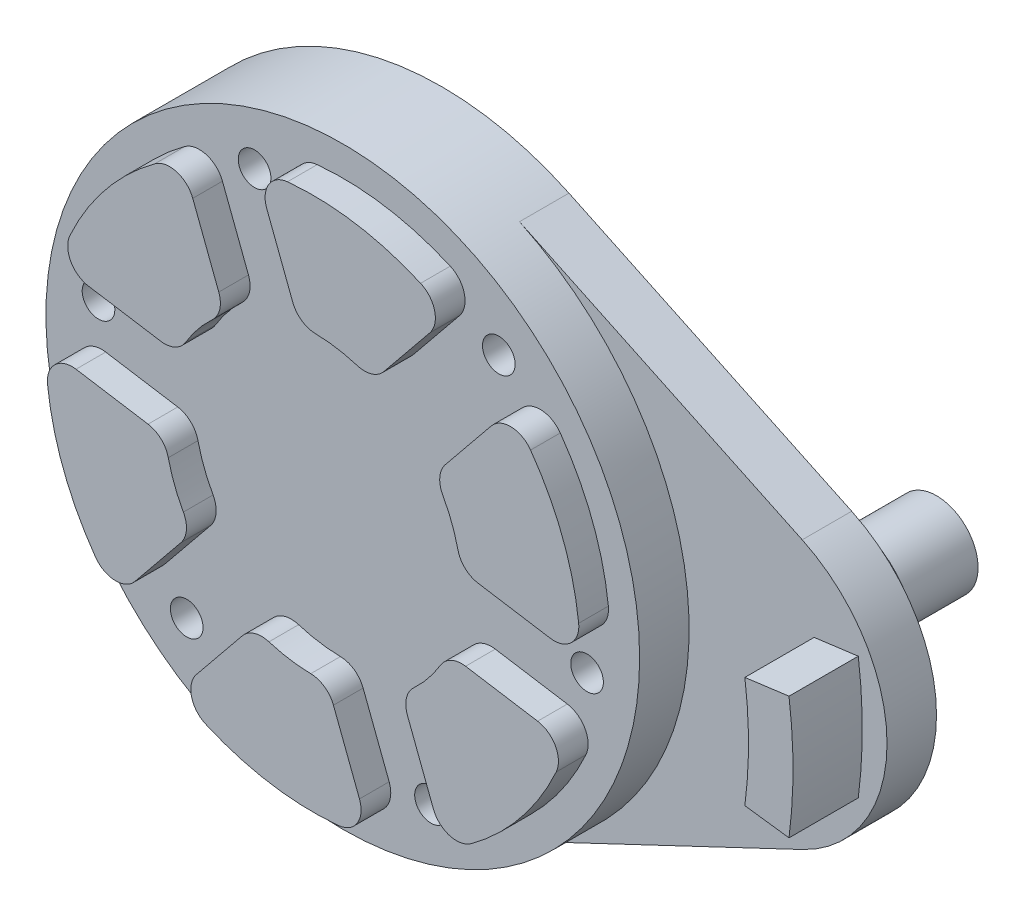
from build123d import *

# Parameters (mm, degrees)
EXTRUDE_1_DEPTH     = 10
EXTRUDE_2_DEPTH     = 3
CUT_EXTRUDE_1_DEPTH = 60.160797831
CUT_EXTRUDE_START   = -5
CUT_EXTRUDE_2_DEPTH = 5
SKETCH_6_R          = 4.2
EXTRUDE_3_DEPTH     = 15
SKETCH_7_R          = 8
EXTRUDE_4_DEPTH     = 5
EXTRUDE_6_DEPTH     = 7


with BuildPart() as part:
    # 草图1 → 凸台-拉伸1 (new body)
    with BuildSketch(Plane.XY):
        with BuildLine():
            Line((12.857142857, 27.105237087), (41.428571429, 13.552618544))
            ThreePointArc((41.428571429, 13.552618544), (50, 0), (41.428571429, -13.552618544))
            Line((41.428571429, -13.552618544), (12.857142857, -27.105237087))
            ThreePointArc((12.857142857, -27.105237087), (-30, 0), (12.857142857, 27.105237087))
        make_face()
    extrude(amount=EXTRUDE_1_DEPTH)

    # 草图2 → 凸台-拉伸2 (add)
    with BuildSketch(Plane.XY.offset(10)):
        with BuildLine():
            Line((23.957377721, 0.209887463), (16.67642367, 1.377277592))
            ThreePointArc((16.67642367, 1.377277592), (15.360611936, 2.023540765), (14.633319135, 3.296357245))
            ThreePointArc((14.633319135, 3.296357245), (14.013905466, 5.34887405), (13.10820337, 7.292119336))
            ThreePointArc((13.10820337, 7.292119336), (12.830802367, 8.073818452), (12.824431404, 8.903254546))
            ThreePointArc((12.824431404, 8.903254546), (13.010978482, 9.528656304), (13.353035008, 10.084466078))
            Line((13.353035008, 10.084466078), (18.004501541, 15.806262185))
            ThreePointArc((18.004501541, 15.806262185), (20.022964964, 16.728032941), (21.979510308, 15.681234856))
            ThreePointArc((21.979510308, 15.681234856), (25.225029838, 9.62797329), (26.838176005, 2.95166203))
            ThreePointArc((26.838176005, 2.95166203), (26.85239584, 2.616563886), (26.821632235, 2.282578003))
            ThreePointArc((26.821632235, 2.282578003), (25.818773244, 0.6530262), (23.957377721, 0.209887463))
        make_face()
        with BuildLine():
            Line((15.409921311, -6.521834496), (22.690875361, -7.689224625))
            ThreePointArc((22.690875361, -7.689224625), (24.498383964, -8.976379847), (24.570102902, -11.194196862))
            ThreePointArc((24.570102902, -11.194196862), (20.950584375, -17.031530006), (15.975302304, -21.766711196))
            ThreePointArc((15.975302304, -21.766711196), (15.692208716, -21.946575006), (15.387586654, -22.086925885))
            ThreePointArc((15.387586654, -22.086925885), (13.4749239, -22.033200424), (12.160456735, -20.642753983))
            Line((12.160456735, -20.642753983), (9.530969218, -13.753567747))
            ThreePointArc((9.530969218, -13.753567747), (9.432743676, -12.290909771), (10.171388682, -11.02464749))
            ThreePointArc((10.171388682, -11.02464749), (11.639213542, -9.461961114), (12.869262278, -7.705977448))
            ThreePointArc((12.869262278, -7.705977448), (13.407533068, -7.074891575), (14.122660315, -6.654656112))
            ThreePointArc((14.122660315, -6.654656112), (14.757547664, -6.503509741), (15.409921311, -6.521834496))
        make_face()
        with BuildLine():
            Line((2.056886303, -16.606300573), (4.68637382, -23.49548681))
            ThreePointArc((4.68637382, -23.49548681), (4.475419, -25.704412788), (2.590592594, -26.875431718))
            ThreePointArc((2.590592594, -26.875431718), (-4.274445463, -26.659503296), (-10.862873701, -24.718373226))
            ThreePointArc((-10.862873701, -24.718373226), (-11.160187124, -24.563138893), (-11.434045581, -24.369503888))
            ThreePointArc((-11.434045581, -24.369503888), (-12.343849344, -22.686226624), (-11.796920986, -20.852641446))
            Line((-11.796920986, -20.852641446), (-7.145454452, -15.130845339))
            ThreePointArc((-7.145454452, -15.130845339), (-5.92786826, -14.314450537), (-4.461930453, -14.321004735))
            ThreePointArc((-4.461930453, -14.321004735), (-2.374691924, -14.810835164), (-0.238941092, -14.998096784))
            ThreePointArc((-0.238941092, -14.998096784), (0.576730701, -15.148710026), (1.298228911, -15.557910658))
            ThreePointArc((1.298228911, -15.557910658), (1.746569183, -16.032166046), (2.056886303, -16.606300573))
        make_face()
        with BuildLine():
            Line((-13.353035008, -10.084466078), (-18.004501541, -15.806262185))
            ThreePointArc((-18.004501541, -15.806262185), (-20.022964964, -16.728032941), (-21.979510308, -15.681234856))
            ThreePointArc((-21.979510308, -15.681234856), (-25.225029838, -9.62797329), (-26.838176005, -2.95166203))
            ThreePointArc((-26.838176005, -2.95166203), (-26.85239584, -2.616563886), (-26.821632235, -2.282578003))
            ThreePointArc((-26.821632235, -2.282578003), (-25.818773244, -0.6530262), (-23.957377721, -0.209887463))
            Line((-23.957377721, -0.209887463), (-16.67642367, -1.377277592))
            ThreePointArc((-16.67642367, -1.377277592), (-15.360611936, -2.023540765), (-14.633319135, -3.296357245))
            ThreePointArc((-14.633319135, -3.296357245), (-14.013905466, -5.34887405), (-13.10820337, -7.292119336))
            ThreePointArc((-13.10820337, -7.292119336), (-12.830802367, -8.073818452), (-12.824431404, -8.903254546))
            ThreePointArc((-12.824431404, -8.903254546), (-13.010978482, -9.528656304), (-13.353035008, -10.084466078))
        make_face()
        with BuildLine():
            Line((-15.409921311, 6.521834496), (-22.690875361, 7.689224625))
            ThreePointArc((-22.690875361, 7.689224625), (-24.498383964, 8.976379847), (-24.570102902, 11.194196862))
            ThreePointArc((-24.570102902, 11.194196862), (-20.950584375, 17.031530006), (-15.975302304, 21.766711196))
            ThreePointArc((-15.975302304, 21.766711196), (-15.692208716, 21.946575006), (-15.387586654, 22.086925885))
            ThreePointArc((-15.387586654, 22.086925885), (-13.4749239, 22.033200424), (-12.160456735, 20.642753983))
            Line((-12.160456735, 20.642753983), (-9.530969218, 13.753567747))
            ThreePointArc((-9.530969218, 13.753567747), (-9.432743676, 12.290909771), (-10.171388682, 11.02464749))
            ThreePointArc((-10.171388682, 11.02464749), (-11.639213542, 9.461961114), (-12.869262278, 7.705977448))
            ThreePointArc((-12.869262278, 7.705977448), (-13.407533068, 7.074891575), (-14.122660315, 6.654656112))
            ThreePointArc((-14.122660315, 6.654656112), (-14.757547664, 6.503509741), (-15.409921311, 6.521834496))
        make_face()
        with BuildLine():
            Line((-2.056886303, 16.606300573), (-4.68637382, 23.49548681))
            ThreePointArc((-4.68637382, 23.49548681), (-4.475419, 25.704412788), (-2.590592594, 26.875431718))
            ThreePointArc((-2.590592594, 26.875431718), (4.274445463, 26.659503296), (10.862873701, 24.718373226))
            ThreePointArc((10.862873701, 24.718373226), (11.160187124, 24.563138893), (11.434045581, 24.369503888))
            ThreePointArc((11.434045581, 24.369503888), (12.343849344, 22.686226624), (11.796920986, 20.852641446))
            Line((11.796920986, 20.852641446), (7.145454452, 15.130845339))
            ThreePointArc((7.145454452, 15.130845339), (5.92786826, 14.314450537), (4.461930453, 14.321004735))
            ThreePointArc((4.461930453, 14.321004735), (2.374691924, 14.810835164), (0.238941092, 14.998096784))
            ThreePointArc((0.238941092, 14.998096784), (-0.576730701, 15.148710026), (-1.298228911, 15.557910658))
            ThreePointArc((-1.298228911, 15.557910658), (-1.746569183, 16.032166046), (-2.056886303, 16.606300573))
        make_face()
    extrude(amount=EXTRUDE_2_DEPTH)

    # 草图4 → 切除-拉伸1 (cut, through all)
    with BuildSketch(Plane.XY.offset(10)):
        with BuildLine():
            ThreePointArc((26.313917142, -4.219035984), (24.945941386, -2.328628005), (23.055533406, -3.696603761))
            ThreePointArc((23.055533406, -3.696603761), (24.423509162, -5.587011741), (26.313917142, -4.219035984))
        make_face()
        with BuildLine():
            ThreePointArc((9.503166229, -24.89803871), (10.456319685, -22.768132964), (8.326413938, -21.814979508))
            ThreePointArc((8.326413938, -21.814979508), (7.373260482, -23.944885255), (9.503166229, -24.89803871))
        make_face()
        with BuildLine():
            ThreePointArc((-16.810750913, -20.679002726), (-14.489621701, -20.439504959), (-14.729119468, -18.118375747))
            ThreePointArc((-14.729119468, -18.118375747), (-17.05024868, -18.357873514), (-16.810750913, -20.679002726))
        make_face()
        with BuildLine():
            ThreePointArc((-26.313917142, 4.219035984), (-24.945941386, 2.328628005), (-23.055533406, 3.696603761))
            ThreePointArc((-23.055533406, 3.696603761), (-24.423509162, 5.587011741), (-26.313917142, 4.219035984))
        make_face()
        with BuildLine():
            ThreePointArc((-9.503166229, 24.89803871), (-10.456319685, 22.768132964), (-8.326413938, 21.814979508))
            ThreePointArc((-8.326413938, 21.814979508), (-7.373260482, 23.944885255), (-9.503166229, 24.89803871))
        make_face()
        with BuildLine():
            ThreePointArc((16.810750913, 20.679002726), (14.489621701, 20.439504959), (14.729119468, 18.118375747))
            ThreePointArc((14.729119468, 18.118375747), (17.05024868, 18.357873514), (16.810750913, 20.679002726))
        make_face()
    extrude(amount=-CUT_EXTRUDE_1_DEPTH, mode=Mode.SUBTRACT)

    # 草图5 → 切除-拉伸2 (cut)
    with BuildSketch(Plane.XY.offset(10).offset(CUT_EXTRUDE_START)):
        with BuildLine():
            Line((41.428571429, 13.552618544), (12.857142857, 27.105237087))
            ThreePointArc((12.857142857, 27.105237087), (30, 0), (12.857142857, -27.105237087))
            Line((12.857142857, -27.105237087), (41.428571429, -13.552618544))
            ThreePointArc((41.428571429, -13.552618544), (50, 0), (41.428571429, 13.552618544))
        make_face()
    extrude(amount=CUT_EXTRUDE_2_DEPTH, mode=Mode.SUBTRACT)

    # 草图6 → 凸台-拉伸3 (add)
    with BuildSketch(Plane(origin=(0, 0, 0), x_dir=(-1, 0, 0), z_dir=(0, 0, -1))):
        with Locations(Location((-35, 0, 0), (0, 0, 180))):
            Circle(SKETCH_6_R)
    extrude(amount=EXTRUDE_3_DEPTH)

    # 草图7 → 凸台-拉伸4 (add)
    with BuildSketch(Plane(origin=(0, 0, 0), x_dir=(-1, 0, 0), z_dir=(0, 0, -1))):
        with Locations(Location((-35, 0, 0), (0, 0, 180))):
            Circle(SKETCH_7_R)
    extrude(amount=EXTRUDE_4_DEPTH)

    # 草图8 → 凸台-拉伸6 (add)
    with BuildSketch(Plane.XY.offset(5)):
        with BuildLine():
            ThreePointArc((42.632129039, 5.612626265), (42.907933699, 2.812334557), (43, 0))
            Line((43, 0), (47.5, 0))
            ThreePointArc((47.5, 0), (47.398298854, 3.106648638), (47.093630915, 6.19999413))
            Line((47.093630915, 6.19999413), (42.632129039, 5.612626265))
        make_face()
        with BuildLine():
            Line((47.5, 0), (43, 0))
            ThreePointArc((43, 0), (42.907933699, -2.812334557), (42.632129039, -5.612626265))
            Line((42.632129039, -5.612626265), (47.093630915, -6.19999413))
            ThreePointArc((47.093630915, -6.19999413), (47.398298854, -3.106648638), (47.5, 0))
        make_face()
    extrude(amount=EXTRUDE_6_DEPTH)


solid = part.part
